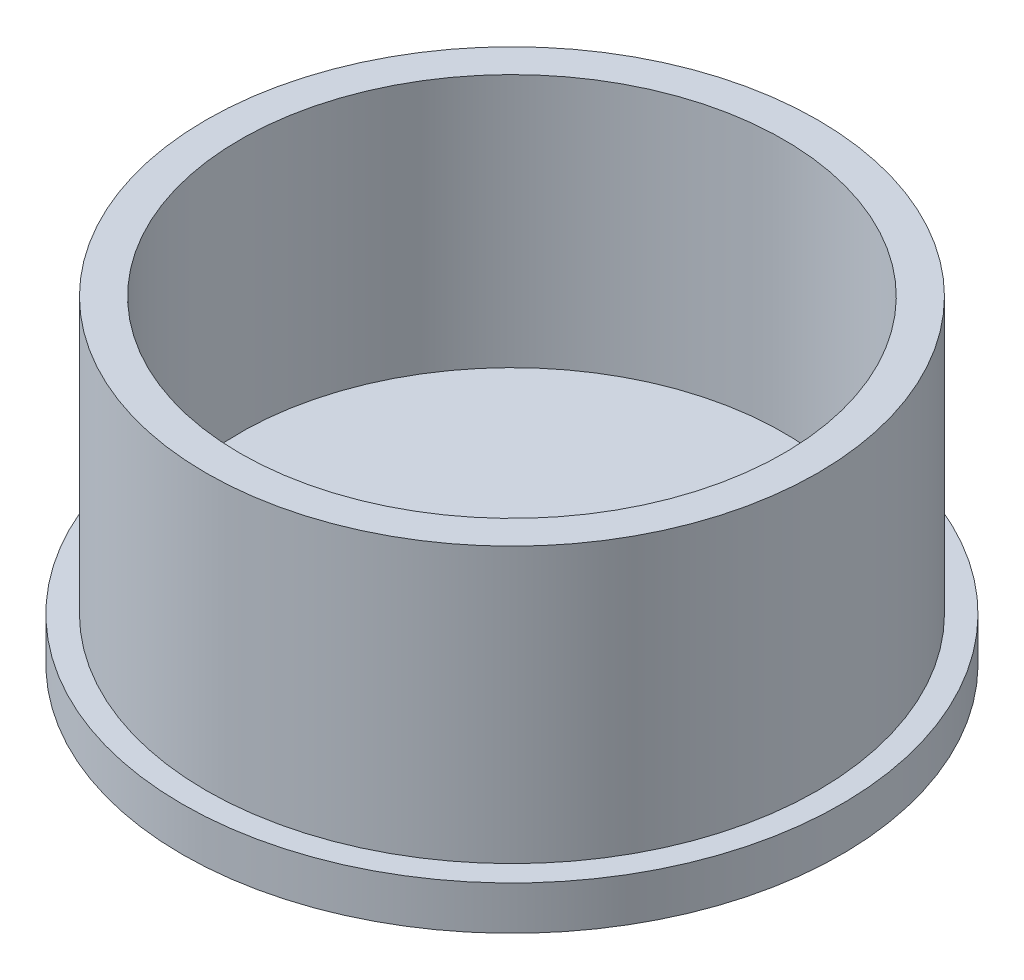
from build123d import *

# Parameters (mm, degrees)
SKETCH1_R           = 11.90625
BOSS_EXTRUDE1_DEPTH = 1.5748
SKETCH2_R           = 11.049
BOSS_EXTRUDE2_DEPTH = 9.9314
SKETCH3_R           = 9.818353869
CUT_EXTRUDE1_DEPTH  = 9.1694


with BuildPart() as part:
    # Sketch1 → Boss-Extrude1 (new body)
    with BuildSketch(Plane(origin=(0, 0, 0), x_dir=(1, 0, 0), z_dir=(0, 1, 0))):
        with Locations(Location((0, 0, 0), (0, 0, 270))):
            Circle(SKETCH1_R)
    extrude(amount=BOSS_EXTRUDE1_DEPTH)

    # Sketch2 → Boss-Extrude2 (add)
    with BuildSketch(Plane(origin=(0, 1.5748, 0), x_dir=(1, 0, 0), z_dir=(0, 1, 0))):
        with Locations(Location((0, 0, 0), (0, 0, 270))):
            Circle(SKETCH2_R)
    extrude(amount=BOSS_EXTRUDE2_DEPTH)

    # Sketch3 → Cut-Extrude1 (cut)
    with BuildSketch(Plane(origin=(0, 11.5062, 0), x_dir=(1, 0, 0), z_dir=(0, 1, 0))):
        with Locations(Location((0, 0, 0), (0, 0, 270))):
            Circle(SKETCH3_R)
    extrude(amount=-CUT_EXTRUDE1_DEPTH, mode=Mode.SUBTRACT)


solid = part.part
